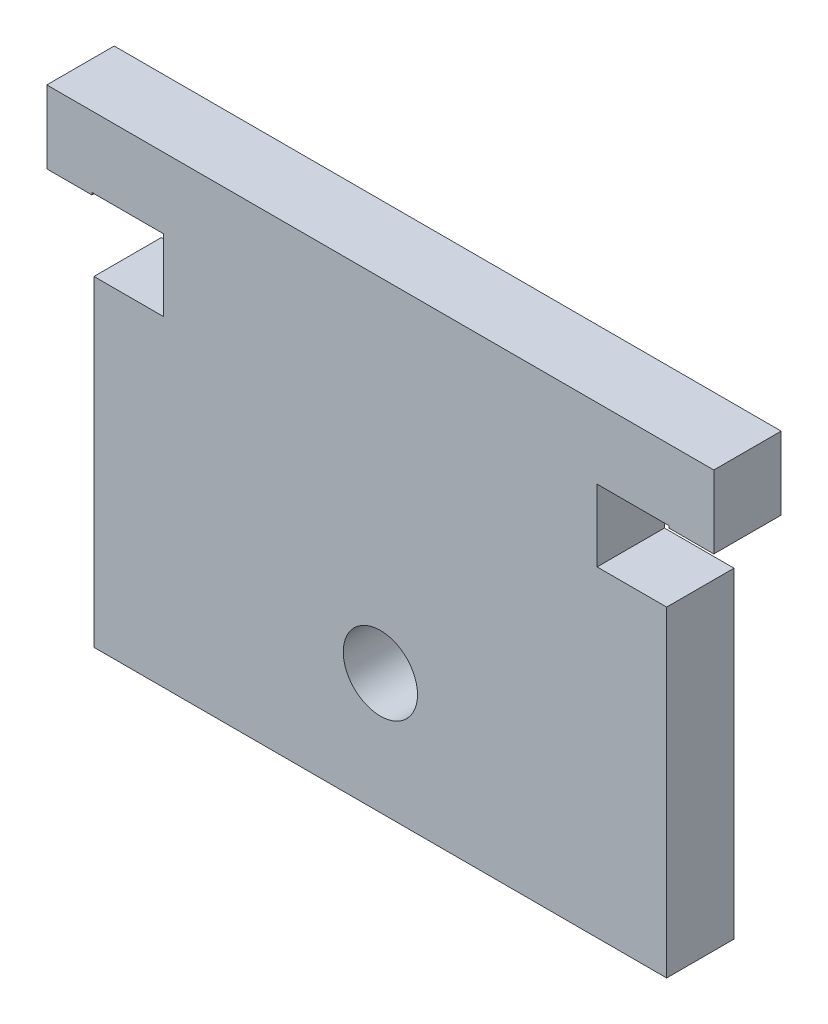
from build123d import *

# Parameters (mm, degrees)
SKETCH1_W            = 85.725
SKETCH1_H            = 50.8
BOSS_EXTRUDE1_DEPTH  = 6.35
SKETCH2_W            = 15.875
SKETCH2_H            = 43.18
CUT_EXTRUDE1_DEPTH   = 6.35
SKETCH3_W            = 85.725
SKETCH3_H            = 6.35
CUT_EXTRUDE2_DEPTH   = 0.762
SKETCH5_W            = 6.35
SKETCH5_H            = 6.35
CUT_EXTRUDE3_DEPTH   = 6.35
SKETCH7_W            = 6.35
SKETCH7_H            = 6.858
CUT_EXTRUDE5_DEPTH   = 11.43
SKETCH8_W            = 53.975
SKETCH8_H            = 6.35
CUT_EXTRUDE6_DEPTH   = 6.35
M6_CLEARANCE_HOLE1_D = 7
SKETCH12_W           = 6.7564
SKETCH12_H           = 6.7564
CUT_EXTRUDE7_DEPTH   = 41.439530169


with BuildPart() as part:
    # Sketch1 → Boss-Extrude1 (new body)
    with BuildSketch(Plane.XY):
        Rectangle(SKETCH1_W, SKETCH1_H)
    extrude(amount=BOSS_EXTRUDE1_DEPTH)

    # Sketch2 → Cut-Extrude1 (cut)
    with BuildSketch(Plane.XY.offset(6.35)):
        with Locations((-34.925, -3.81)):
            Rectangle(SKETCH2_W, SKETCH2_H)
        with Locations((34.925, -3.81)):
            Rectangle(SKETCH2_W, SKETCH2_H)
    extrude(amount=-CUT_EXTRUDE1_DEPTH, mode=Mode.SUBTRACT)

    # Sketch3 → Cut-Extrude2 (cut)
    with BuildSketch(Plane(origin=(0, 25.4, 0), x_dir=(1, 0, 0), z_dir=(0, 1, 0))):
        with Locations((0, -3.175)):
            Rectangle(SKETCH3_W, SKETCH3_H)
    extrude(amount=-CUT_EXTRUDE2_DEPTH, mode=Mode.SUBTRACT)

    # Sketch5 → Cut-Extrude3 (cut)
    with BuildSketch(Plane.ZY.offset(26.9875)):
        with Locations((3.175, 14.605)):
            Rectangle(SKETCH5_W, SKETCH5_H)
    cut_extrude3 = extrude(amount=-CUT_EXTRUDE3_DEPTH, mode=Mode.SUBTRACT)

    # Mirror1: Cut-Extrude3 across plane
    add(cut_extrude3.mirror(Plane(origin=(0, 0, 0), x_dir=(0, 0, 1), z_dir=(1, 0, 0))), mode=Mode.SUBTRACT)

    # Sketch7 → Cut-Extrude5 (cut)
    with BuildSketch(Plane.ZY.offset(42.8625)):
        with Locations((3.175, 21.209)):
            Rectangle(SKETCH7_W, SKETCH7_H)
    cut_extrude5 = extrude(amount=-CUT_EXTRUDE5_DEPTH, mode=Mode.SUBTRACT)

    # Mirror2: Cut-Extrude5 across plane
    add(cut_extrude5.mirror(Plane(origin=(0, 0, 0), x_dir=(0, 0, 1), z_dir=(1, 0, 0))), mode=Mode.SUBTRACT)

    # Sketch8 → Cut-Extrude6 (cut)
    with BuildSketch(Plane.XZ.offset(25.4)):
        with Locations((0, 3.175)):
            Rectangle(SKETCH8_W, SKETCH8_H)
    extrude(amount=-CUT_EXTRUDE6_DEPTH, mode=Mode.SUBTRACT)

    # M6 Clearance Hole1 (through all)
    with Locations(Plane.XY.offset(6.35)):
        with Locations((0.00592, -7.666260004)):
            Hole(M6_CLEARANCE_HOLE1_D / 2)

    # Sketch12 → Cut-Extrude7 (cut, through all)
    with BuildSketch(Plane.XY.offset(6.35)):
        with Locations((-23.8125, 14.605)):
            Rectangle(SKETCH12_W, SKETCH12_H)
        with Locations((23.8125, 14.605)):
            Rectangle(SKETCH12_W, SKETCH12_H)
    extrude(amount=-CUT_EXTRUDE7_DEPTH, mode=Mode.SUBTRACT)


solid = part.part
